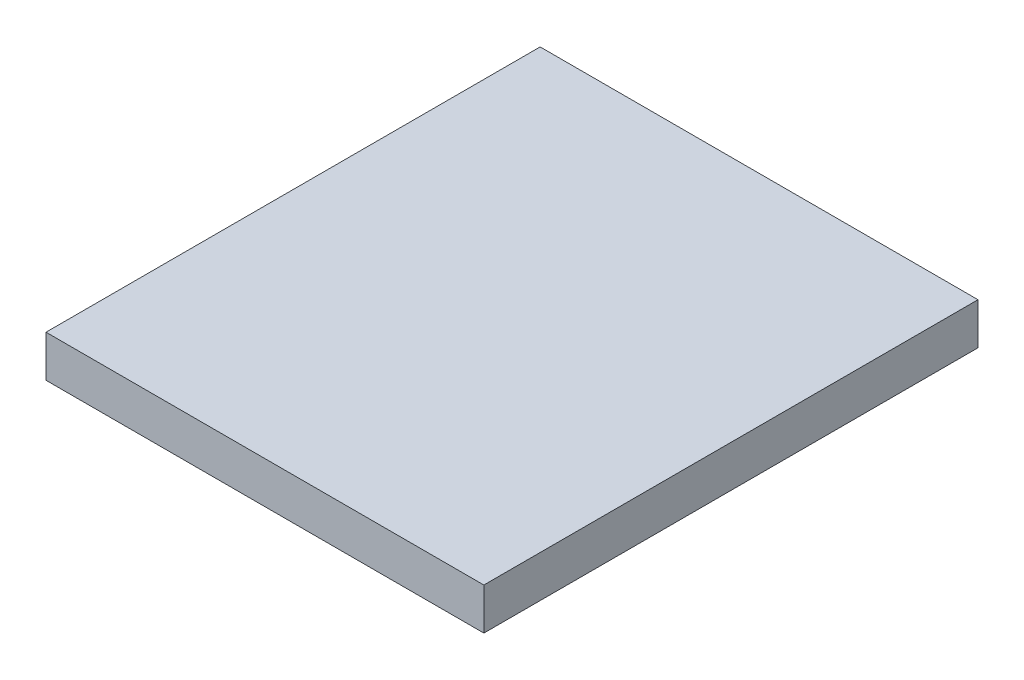
from build123d import *

# Parameters (mm, degrees)
SKETCH1_W           = 200.26334039
SKETCH1_H           = 19.05
BOSS_EXTRUDE1_DEPTH = 226


with BuildPart() as part:
    # Sketch1 → Boss-Extrude1 (new body)
    with BuildSketch(Plane.XY):
        with Locations((0, -4.525)):
            Rectangle(SKETCH1_W, SKETCH1_H)
    extrude(amount=BOSS_EXTRUDE1_DEPTH)


solid = part.part
